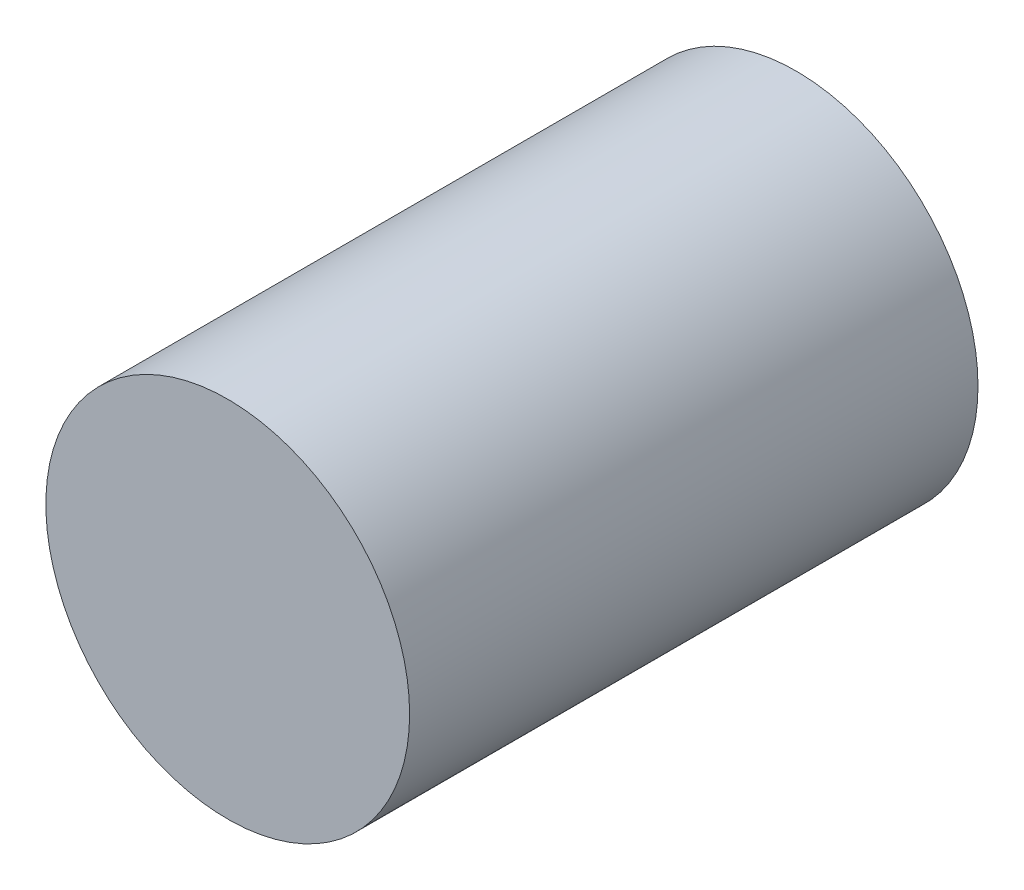
from build123d import *

# Parameters (mm, degrees)
CROQUIS1_R              = 8
SALIENTE_EXTRUIR1_DEPTH = 25


with BuildPart() as part:
    # Croquis1 → Saliente-Extruir1 (new body)
    with BuildSketch(Plane.XY):
        Circle(CROQUIS1_R)
    extrude(amount=SALIENTE_EXTRUIR1_DEPTH)


solid = part.part
